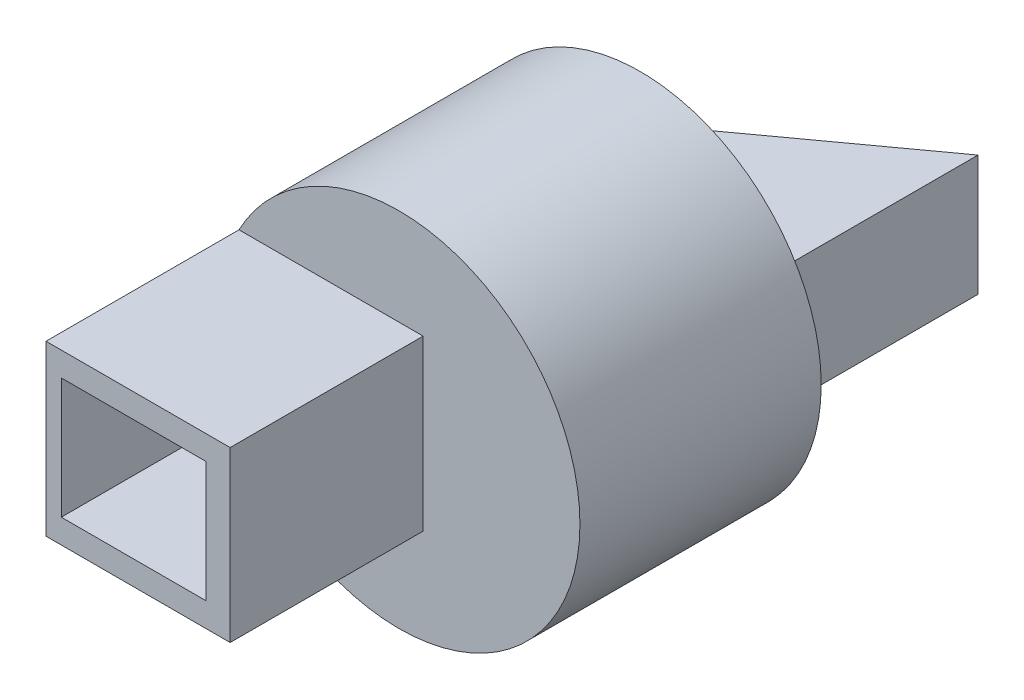
from build123d import *

# Parameters (mm, degrees)
CROQUIS1_W              = 100
CROQUIS1_H              = 50
CROQUIS1_W_2            = 96
CROQUIS1_H_2            = 46
SALIENTE_EXTRUIR1_DEPTH = 100
CORTAR_EXTRUIR1_DEPTH   = 100
CROQUIS3_R              = 75
CROQUIS3_W              = 100
CROQUIS3_H              = 50
SALIENTE_EXTRUIR2_DEPTH = 10
SALIENTE_EXTRUIR3_START = 80
CROQUIS4_R              = 75
CROQUIS4_R_2            = 65
SALIENTE_EXTRUIR3_DEPTH = 80
SALIENTE_EXTRUIR4_START = 10
CROQUIS5_R              = 75
CROQUIS5_W              = 60
CROQUIS5_H              = 50
SALIENTE_EXTRUIR4_DEPTH = 10
CROQUIS6_W              = 76.332495807
CROQUIS6_H              = 70
CROQUIS6_W_2            = 60
CROQUIS6_H_2            = 50
SALIENTE_EXTRUIR5_DEPTH = 80


with BuildPart() as part:
    # Croquis1 → Saliente-Extruir1 (new body)
    with BuildSketch(Plane.XY):
        Rectangle(CROQUIS1_W, CROQUIS1_H)
        Rectangle(CROQUIS1_W_2, CROQUIS1_H_2, mode=Mode.SUBTRACT)
    extrude(amount=SALIENTE_EXTRUIR1_DEPTH)

    # Croquis2 → Cortar-Extruir1 (cut)
    with BuildSketch(Plane(origin=(0, 25, 0), x_dir=(1, 0, 0), z_dir=(0, 1, 0))):
        Polygon((-50, 0), (50, 0), (-50, -72.654252801), align=None)
    extrude(amount=-CORTAR_EXTRUIR1_DEPTH, mode=Mode.SUBTRACT)

    # Croquis3 → Saliente-Extruir2 (add)
    with BuildSketch(Plane.XY.offset(100)):
        Circle(CROQUIS3_R)
        Rectangle(CROQUIS3_W, CROQUIS3_H, mode=Mode.SUBTRACT)
    extrude(amount=-SALIENTE_EXTRUIR2_DEPTH)

    # Croquis4 → Saliente-Extruir3 (add)
    with BuildSketch(Plane.XY.offset(100).offset(SALIENTE_EXTRUIR3_START)):
        Circle(CROQUIS4_R)
        Circle(CROQUIS4_R_2, mode=Mode.SUBTRACT)
    extrude(amount=-SALIENTE_EXTRUIR3_DEPTH)

    # Croquis5 → Saliente-Extruir4 (add)
    with BuildSketch(Plane.XY.offset(180).offset(SALIENTE_EXTRUIR4_START)):
        Circle(CROQUIS5_R)
        with Locations((-30, 0)):
            Rectangle(CROQUIS5_W, CROQUIS5_H, mode=Mode.SUBTRACT)
    extrude(amount=-SALIENTE_EXTRUIR4_DEPTH)

    # Croquis6 → Saliente-Extruir5 (add)
    with BuildSketch(Plane.XY.offset(190)):
        with Locations((-28.166247904, 0)):
            Rectangle(CROQUIS6_W, CROQUIS6_H)
        with Locations((-30, 0)):
            Rectangle(CROQUIS6_W_2, CROQUIS6_H_2, mode=Mode.SUBTRACT)
    extrude(amount=SALIENTE_EXTRUIR5_DEPTH)


solid = part.part
